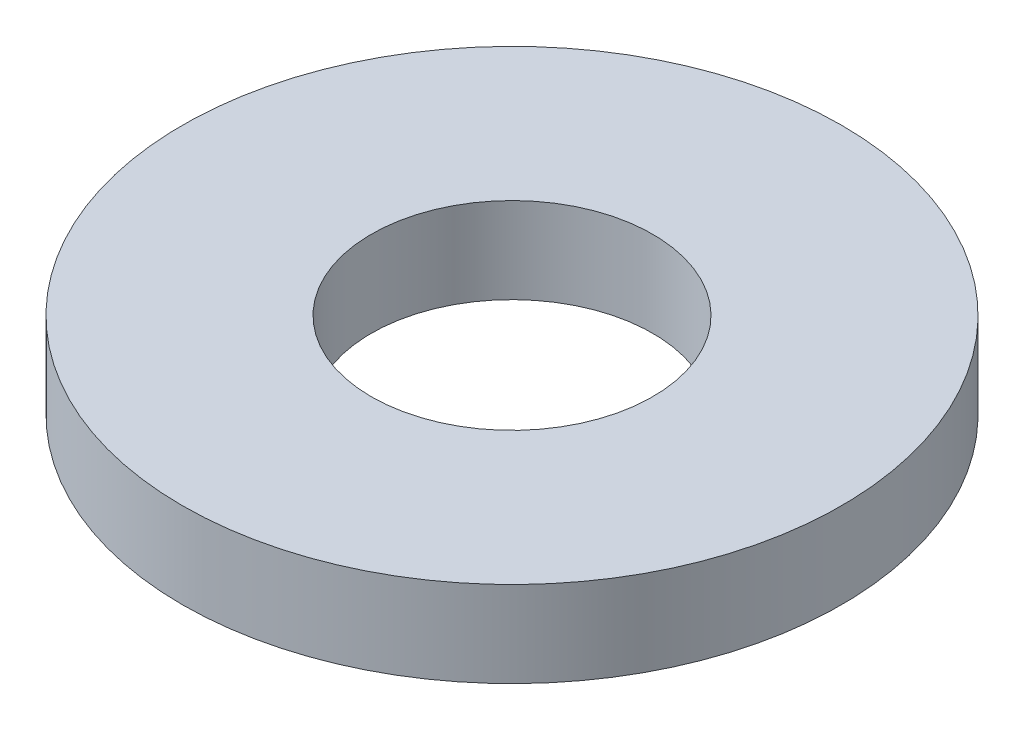
from build123d import *

# Parameters (mm, degrees)
BOSS_EXTRUDE1_DEPTH      = 0.625
BOSS_EXTRUDE1_DEPTH_BACK = 0.625
SKETCH1_R                = 4.8
SKETCH1_R_2              = 2.05


with BuildPart() as part:
    # Sketch1 → Boss-Extrude1 (new, two sides: drawn at the far end of the back side and taken through both)
    with BuildSketch(Plane(origin=(0, 0, 0), x_dir=(1, 0, 0), z_dir=(0, 1, 0)).offset(-BOSS_EXTRUDE1_DEPTH_BACK)):
        Circle(SKETCH1_R)
        Circle(SKETCH1_R_2, mode=Mode.SUBTRACT)
    extrude(amount=BOSS_EXTRUDE1_DEPTH + BOSS_EXTRUDE1_DEPTH_BACK)


solid = part.part
